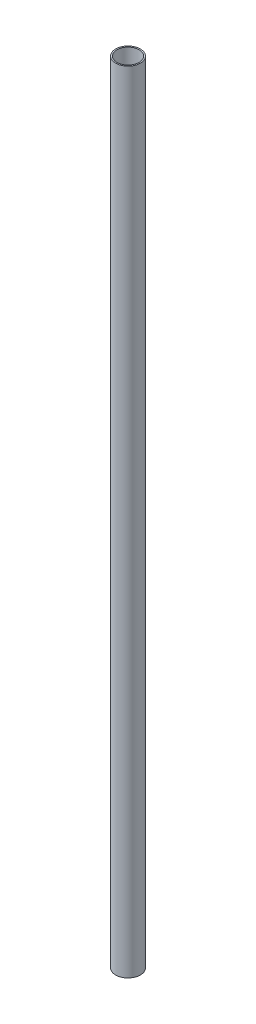
from build123d import *

# Parameters (mm, degrees)
SKETCH1_R           = 4.7625
SKETCH1_R_2         = 4.2545
BOSS_EXTRUDE1_DEPTH = 304.8


with BuildPart() as part:
    # Sketch1 → Boss-Extrude1 (new body)
    with BuildSketch(Plane(origin=(0, 0, 0), x_dir=(1, 0, 0), z_dir=(0, 1, 0))):
        with Locations(Location((0, 0, 0), (0, 0, 90))):
            Circle(SKETCH1_R)
        with Locations(Location((0, 0, 0), (0, 0, 90))):
            Circle(SKETCH1_R_2, mode=Mode.SUBTRACT)
    extrude(amount=BOSS_EXTRUDE1_DEPTH)


solid = part.part
